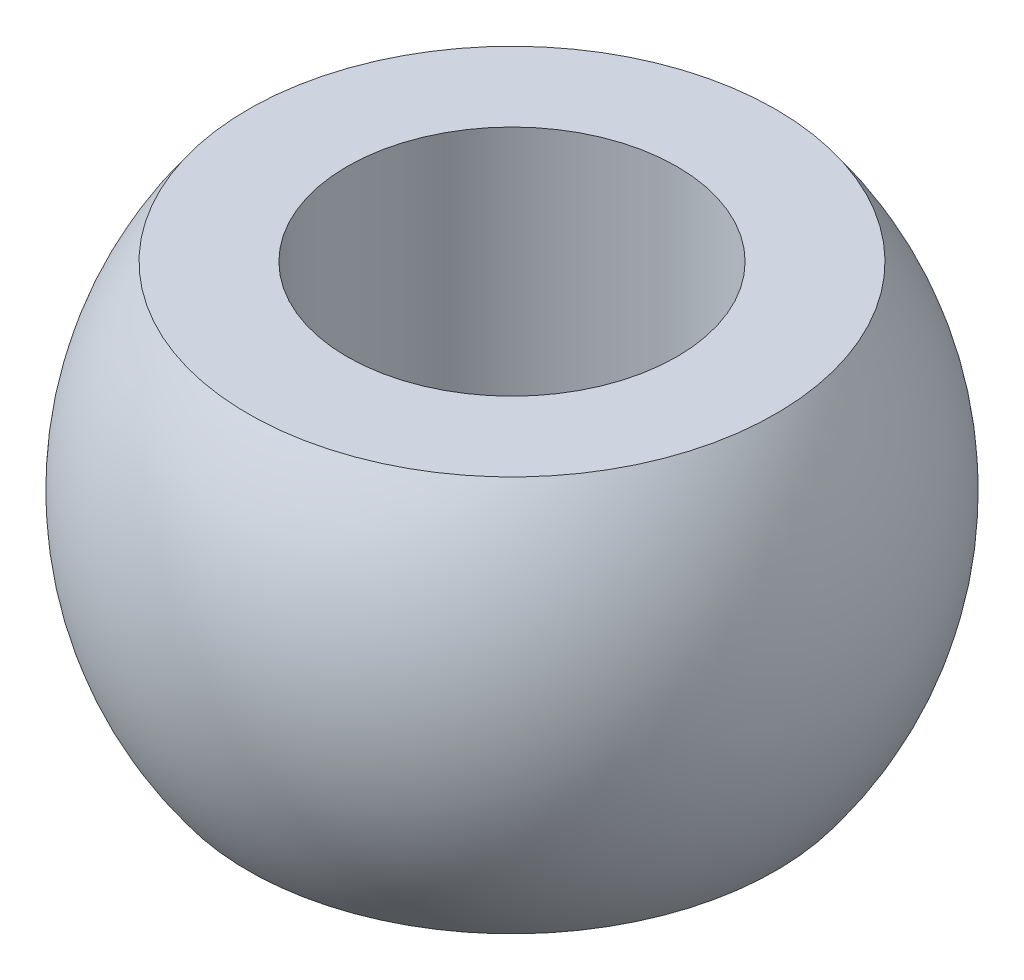
from build123d import *


with BuildPart() as part:
    # Croquis1 → Revolución1 (revolve)
    with BuildSketch(Plane(origin=(0, 0, 0), x_dir=(0, 0, -1), z_dir=(1, 0, 0))):
        with BuildLine():
            Line((3.96875, 4.7625), (3.96875, -4.7625))
            Line((3.96875, -4.7625), (6.35, -4.7625))
            ThreePointArc((6.35, -4.7625), (7.9375, 0), (6.35, 4.7625))
            Line((6.35, 4.7625), (3.96875, 4.7625))
        make_face()
    revolve(axis=Axis((0, -4.7625, 0), (0, 1, 0)))


solid = part.part
